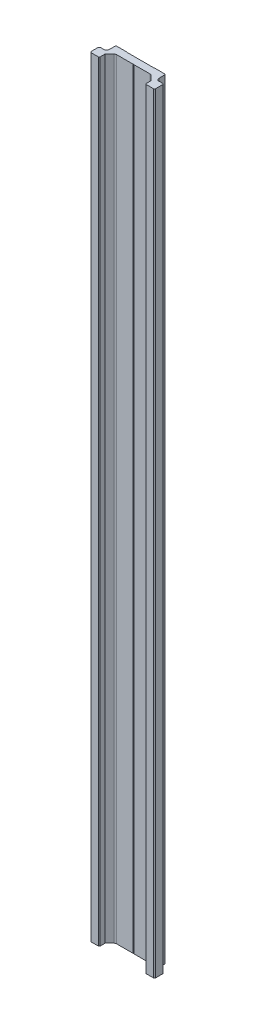
from build123d import *

# Parameters (mm, degrees)
BOSS_EXTRUDE1_DEPTH = 418


with BuildPart() as part:
    # Sketch1 → Boss-Extrude1 (new body)
    with BuildSketch(Plane(origin=(0, 200, 0), x_dir=(1, 0, 0), z_dir=(0, 1, 0))):
        with BuildLine():
            Line((1e-09, -3.855700002), (0.25, -4.00003757))
            Line((0.25, -4.00003757), (9.078700232, -4.00003757))
            ThreePointArc((9.078700232, -4.00003757), (9.652725366, -4.114218268), (10.139360377, -4.439377387))
            Line((10.139360377, -4.439377387), (12.500020747, -6.800037757))
            Line((12.500020747, -6.800037757), (12.500020747, -9.500037757))
            Line((12.500020747, -9.500037757), (13.00002072, -10.000037755))
            Line((13.00002072, -10.000037755), (17.00002072, -10.000037755))
            Line((17.00002072, -10.000037755), (17.500020747, -9.500037752))
            Line((17.500020747, -9.500037752), (17.500020747, -5.500037752))
            Line((17.500020747, -5.500037752), (17.00002075, -5.0000377))
            Line((17.00002075, -5.0000377), (14.30002072, -5.0000377))
            Line((14.30002072, -5.0000377), (14.085807141, -4.785824121))
            ThreePointArc((14.085807141, -4.785824121), (13.652261651, -4.136977442), (13.50002072, -3.371610598))
            Line((13.50002072, -3.371610598), (13.50002072, -0.30003757))
            Line((13.50002072, -0.30003757), (13.20002072, -3.757e-05))
            Line((13.20002072, -3.757e-05), (7.50002072, -3.757e-05))
            Line((7.50002072, -3.757e-05), (7.40002072, -0.10003757))
            Line((7.40002072, -0.10003757), (-7.40002072, -0.10003757))
            Line((-7.40002072, -0.10003757), (-7.50002072, -3.757e-05))
            Line((-7.50002072, -3.757e-05), (-13.20002072, -3.757e-05))
            Line((-13.20002072, -3.757e-05), (-13.50002072, -0.30003757))
            Line((-13.50002072, -0.30003757), (-13.50002072, -3.371610628))
            ThreePointArc((-13.50002072, -3.371610628), (-13.652261651, -4.136977472), (-14.085807141, -4.785824151))
            Line((-14.085807141, -4.785824151), (-14.30002069, -5.0000377))
            Line((-14.30002069, -5.0000377), (-17.00002072, -5.0000377))
            Line((-17.00002072, -5.0000377), (-17.50002072, -5.50003767))
            Line((-17.50002072, -5.50003767), (-17.50002072, -9.50003767))
            Line((-17.50002072, -9.50003767), (-17.000020665, -10.000037755))
            Line((-17.000020665, -10.000037755), (-13.00002072, -10.000037755))
            Line((-13.00002072, -10.000037755), (-12.500020741, -9.500037764))
            Line((-12.500020741, -9.500037764), (-12.500020741, -6.800037764))
            Line((-12.500020741, -6.800037764), (-10.139360364, -4.439377387))
            ThreePointArc((-10.139360364, -4.439377387), (-9.652725352, -4.114218268), (-9.078700218, -4.00003757))
            Line((-9.078700218, -4.00003757), (-0.25, -4.00003757))
            Line((-0.25, -4.00003757), (1e-09, -3.855700002))
        make_face()
    extrude(amount=-BOSS_EXTRUDE1_DEPTH)


solid = part.part
